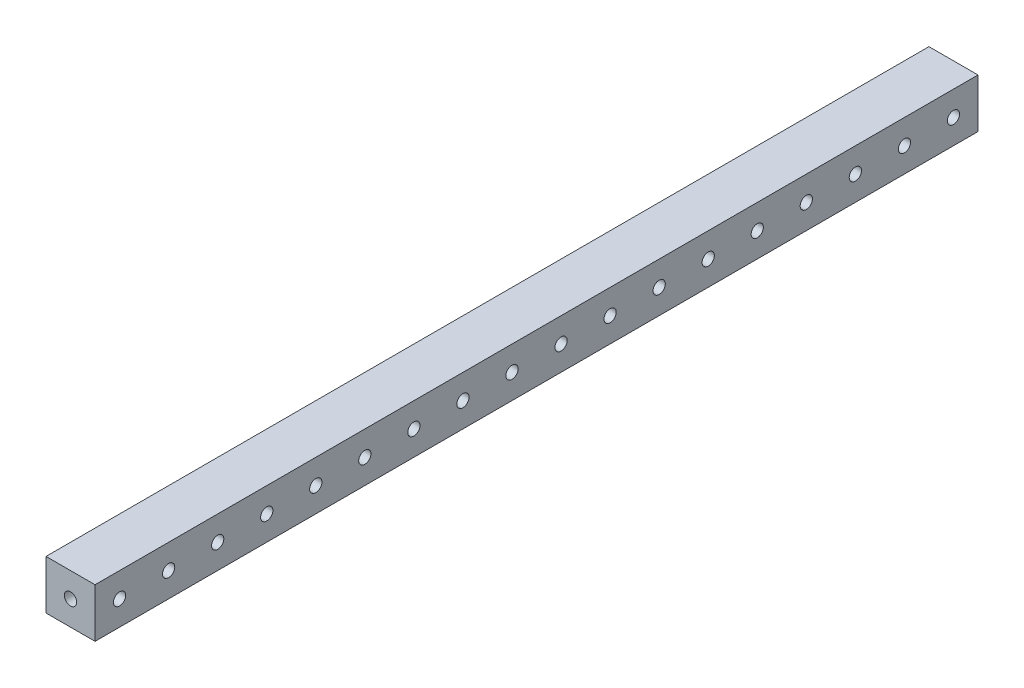
from build123d import *

# Parameters (mm, degrees)
SKETCH1_W             = 20
SKETCH1_H             = 20
BOSS_EXTRUDE1_DEPTH   = 180
F_5_0MM_DOWEL_HOLE1_D = 5
LPATTERN2_COUNT       = 18
LPATTERN2_PITCH       = 20


with BuildPart() as part:
    # Sketch1 → Boss-Extrude1 (new, symmetric)
    with BuildSketch(Plane.XY):
        Rectangle(SKETCH1_W, SKETCH1_H)
    extrude(amount=BOSS_EXTRUDE1_DEPTH, both=True)

    # Ø5.0mm Dowel Hole1 (through all)
    with Locations(Plane(origin=(10, 0, 0), x_dir=(0, 0, -1), z_dir=(1, 0, 0))):
        with Locations((170, 0)):
            f_5_0mm_dowel_hole1 = Hole(F_5_0MM_DOWEL_HOLE1_D / 2)

    # LPattern2: Ø5.0mm Dowel Hole1 ×18
    with Locations(*[(0, 0, i * LPATTERN2_PITCH) for i in range(1, LPATTERN2_COUNT)]):
        add(f_5_0mm_dowel_hole1, mode=Mode.SUBTRACT)

    # Sketch5 → Ø5.0mm Dowel Hole2 (revolve, cut)
    with BuildSketch(Plane(origin=(0, 0, 180), x_dir=(0, -1, 0), z_dir=(1, 0, 0))):
        Polygon((0, 0), (0, 21.502151548), (2.5, 20), (2.5, 0), align=None)
    f_5_0mm_dowel_hole2 = revolve(axis=Axis((0, 0, 186.35), (0, 0, -1)), mode=Mode.SUBTRACT)

    # Mirror1: Ø5.0mm Dowel Hole2 across plane
    add(f_5_0mm_dowel_hole2.mirror(Plane.XY), mode=Mode.SUBTRACT)


solid = part.part
